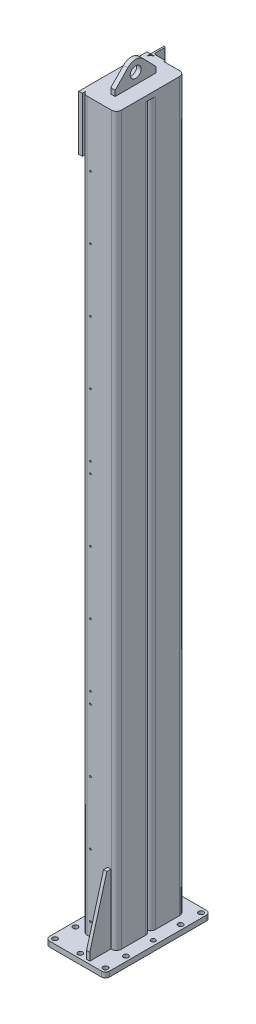
from build123d import *

# Parameters (mm, degrees)
EXTRUDE_1_DEPTH           = 2643
EXTRUDE_2_DEPTH           = 2643
CUT_EXTRUDE_1_DEPTH       = 2648.712267222
CUT_EXTRUDE_1_DEPTH_BACK  = 2648.712267222
EXTRUDE_3_DEPTH           = 19
EXTRUDE_4_DEPTH           = 12
EXTRUDE_5_DEPTH           = 2662
EXTRUDE_6_DEPTH           = 2190
EXTRUDE_7_DEPTH           = 19
SKETCH_14_W               = 249.98
SKETCH_14_H               = 200
EXTRUDE_8_DEPTH           = 13
EXTRUDE_9_DEPTH           = 8
EXTRUDE_9_DEPTH_BACK      = 8
SKETCH_17_R               = 9
CUT_EXTRUDE_3_DEPTH       = 19
SKETCH_19_R               = 8
CUT_EXTRUDE_5_DEPTH       = 19
SKETCH_20_R               = 8
CUT_EXTRUDE_6_DEPTH       = 75.5
SKETCH_21_R               = 8
CUT_EXTRUDE_7_DEPTH       = 75.5
SKETCH_22_R               = 6
CUT_EXTRUDE_8_DEPTH       = 70.5
SKETCH_24_R               = 3
CUT_EXTRUDE_10_DEPTH      = 105
SKETCH_25_R               = 3
CUT_EXTRUDE_11_DEPTH      = 62.5
CUT_EXTRUDE_12_DEPTH      = 2771.06245417
CUT_EXTRUDE_12_DEPTH_BACK = 2771.06245417
SKETCH_26_R               = 20


with BuildPart() as part:
    # ｽｹｯﾁ2 → ﾎﾞｽ - 押し出し1 (new body)
    with BuildSketch(Plane(origin=(0, 19, 0), x_dir=(1, 0, 0), z_dir=(0, 1, 0))):
        with BuildLine():
            Line((44.5, -105), (-44.5, -105))
            ThreePointArc((-44.5, -105), (-57.227922061, -99.727922061), (-62.5, -87))
            Line((-62.5, -87), (-62.5, 2))
            ThreePointArc((-62.5, 2), (-57.227922061, 14.727922061), (-44.5, 20))
            Line((-44.5, 20), (44.5, 20))
            ThreePointArc((44.5, 20), (57.227922061, 14.727922061), (62.5, 2))
            Line((62.5, 2), (62.5, -87))
            ThreePointArc((62.5, -87), (57.227922061, -99.727922061), (44.5, -105))
        make_face()
    extrude(amount=EXTRUDE_1_DEPTH)

    # ｽｹｯﾁ3 → ﾎﾞｽ - 押し出し2 (add)
    with BuildSketch(Plane(origin=(0, 19, 0), x_dir=(1, 0, 0), z_dir=(0, 1, 0))):
        with BuildLine():
            Line((44.5, 20), (-44.5, 20))
            ThreePointArc((-44.5, 20), (-57.227922061, 25.272077939), (-62.5, 38))
            Line((-62.5, 38), (-62.5, 127))
            ThreePointArc((-62.5, 127), (-57.227922061, 139.727922061), (-44.5, 145))
            Line((-44.5, 145), (44.5, 145))
            ThreePointArc((44.5, 145), (57.227922061, 139.727922061), (62.5, 127))
            Line((62.5, 127), (62.5, 38))
            ThreePointArc((62.5, 38), (57.227922061, 25.272077939), (44.5, 20))
        make_face()
    extrude(amount=EXTRUDE_2_DEPTH)

    # ｽｹｯﾁ4 → ｶｯﾄ - 押し出し1 (cut, two sides: drawn at the far end of the back side and taken through both)
    with BuildSketch(Plane(origin=(0, 19, 0), x_dir=(1, 0, 0), z_dir=(0, 1, 0)).offset(-CUT_EXTRUDE_1_DEPTH_BACK)):
        with BuildLine():
            Line((44.5, -96), (-44.5, -96))
            ThreePointArc((-44.5, -96), (-50.863961031, -93.363961031), (-53.5, -87))
            Line((-53.5, -87), (-53.5, 2))
            ThreePointArc((-53.5, 2), (-50.863961031, 8.363961031), (-44.5, 11))
            Line((-44.5, 11), (44.5, 11))
            ThreePointArc((44.5, 11), (50.863961031, 8.363961031), (53.5, 2))
            Line((53.5, 2), (53.5, -87))
            ThreePointArc((53.5, -87), (50.863961031, -93.363961031), (44.5, -96))
        make_face()
        with BuildLine():
            Line((44.5, 29), (-44.5, 29))
            ThreePointArc((-44.5, 29), (-50.863961031, 31.636038969), (-53.5, 38))
            Line((-53.5, 38), (-53.5, 127))
            ThreePointArc((-53.5, 127), (-50.863961031, 133.363961031), (-44.5, 136))
            Line((-44.5, 136), (44.5, 136))
            ThreePointArc((44.5, 136), (50.863961031, 133.363961031), (53.5, 127))
            Line((53.5, 127), (53.5, 38))
            ThreePointArc((53.5, 38), (50.863961031, 31.636038969), (44.5, 29))
        make_face()
    extrude(amount=CUT_EXTRUDE_1_DEPTH + CUT_EXTRUDE_1_DEPTH_BACK, mode=Mode.SUBTRACT)

    # ｽｹｯﾁ5 → ﾎﾞｽ - 押し出し3 (add)
    with BuildSketch(Plane(origin=(0, 0, 0), x_dir=(1, 0, 0), z_dir=(0, 1, 0))):
        with BuildLine():
            Line((95, -192.5), (-95, -192.5))
            ThreePointArc((-95, -192.5), (-105.606601718, -188.106601718), (-110, -177.5))
            Line((-110, -177.5), (-110, 177.5))
            ThreePointArc((-110, 177.5), (-105.606601718, 188.106601718), (-95, 192.5))
            Line((-95, 192.5), (95, 192.5))
            ThreePointArc((95, 192.5), (105.606601718, 188.106601718), (110, 177.5))
            Line((110, 177.5), (110, -177.5))
            ThreePointArc((110, -177.5), (105.606601718, -188.106601718), (95, -192.5))
        make_face()
    extrude(amount=EXTRUDE_3_DEPTH)

    # ｽｹｯﾁ7 → ﾎﾞｽ - 押し出し4 (add)
    with BuildSketch(Plane(origin=(42.5, 0, 0), x_dir=(0, 0, -1), z_dir=(1, 0, 0))):
        Polygon((-105, 19), (-105, 272), (-120, 272), (-182.5, 47), (-182.5, 19), align=None)
    extrude(amount=-EXTRUDE_4_DEPTH)

    # ｽｹｯﾁ8 → ﾎﾞｽ - 押し出し5 (add)
    with BuildSketch(Plane(origin=(0, 19, 0), x_dir=(1, 0, 0), z_dir=(0, 1, 0))):
        with BuildLine():
            Line((-62.5, 145), (-12.5, 145))
            Line((-12.5, 145), (-12.5, 147))
            ThreePointArc((-12.5, 147), (-13.671572875, 149.828427125), (-16.5, 151))
            Line((-16.5, 151), (-50.5, 151))
            ThreePointArc((-50.5, 151), (-54.742640687, 152.757359313), (-56.5, 157))
            Line((-56.5, 157), (-56.5, 191))
            ThreePointArc((-56.5, 191), (-57.671572875, 193.828427125), (-60.5, 195))
            Line((-60.5, 195), (-62.5, 195))
            Line((-62.5, 195), (-62.5, 145))
        make_face()
    extrude(amount=EXTRUDE_5_DEPTH)

    # ｽｹｯﾁ10 → ﾎﾞｽ - 押し出し6 (add)
    with BuildSketch(Plane(origin=(0, 169, 0), x_dir=(1, 0, 0), z_dir=(0, 1, 0))):
        Polygon((-62.5, -40), (-74.5, -40), (-74.5, -27.5), (-70.5, -27.5), (-70.5, 35), (-62.5, 35), align=None)
    extrude(amount=EXTRUDE_6_DEPTH)

    # ｽｹｯﾁ12 → ﾎﾞｽ - 押し出し7 (add)
    with BuildSketch(Plane(origin=(0, 2662, 0), x_dir=(1, 0, 0), z_dir=(0, 1, 0))):
        with BuildLine():
            Line((44.5, -105), (-44.5, -105))
            ThreePointArc((-44.5, -105), (-57.227922061, -99.727922061), (-62.5, -87))
            Line((-62.5, -87), (-62.5, 127))
            ThreePointArc((-62.5, 127), (-57.227922061, 139.727922061), (-44.5, 145))
            Line((-44.5, 145), (44.5, 145))
            ThreePointArc((44.5, 145), (57.227922061, 139.727922061), (62.5, 127))
            Line((62.5, 127), (62.5, -87))
            ThreePointArc((62.5, -87), (57.227922061, -99.727922061), (44.5, -105))
        make_face()
    extrude(amount=EXTRUDE_7_DEPTH)

    # ｽｹｯﾁ14 → ﾎﾞｽ - 押し出し8 (add)
    with BuildSketch(Plane(origin=(-62.5, 0, 0), x_dir=(0, 0, -1), z_dir=(1, 0, 0))):
        with Locations((19.99, 2581)):
            Rectangle(SKETCH_14_W, SKETCH_14_H)
    extrude(amount=-EXTRUDE_8_DEPTH)

    # ｽｹｯﾁ15 → ﾎﾞｽ - 押し出し9 (add, two sides: drawn at the far end of the back side and taken through both)
    with BuildSketch(Plane(origin=(0, 0, 0), x_dir=(0, 0, -1), z_dir=(1, 0, 0)).offset(-EXTRUDE_9_DEPTH_BACK)):
        with BuildLine():
            Line((-55, 2681), (95, 2681))
            Line((95, 2681), (95, 2701))
            Line((95, 2701), (48.749632993, 2748.811123724))
            ThreePointArc((48.749632993, 2748.811123724), (20, 2761), (-8.749632993, 2748.811123724))
            Line((-8.749632993, 2748.811123724), (-55, 2701))
            Line((-55, 2701), (-55, 2681))
        make_face()
    extrude(amount=EXTRUDE_9_DEPTH + EXTRUDE_9_DEPTH_BACK)

    # ｽｹｯﾁ17 → ｶｯﾄ - 押し出し3 (cut)
    with BuildSketch(Plane(origin=(0, 0, 0), x_dir=(1, 0, 0), z_dir=(0, 1, 0))):
        with Locations(Location((92.5, -175, 0), (0, 0, 270))):
            Circle(SKETCH_17_R)
        with Locations(Location((0, -175, 0), (0, 0, 270))):
            Circle(SKETCH_17_R)
        with Locations(Location((-92.5, -175, 0), (0, 0, 270))):
            Circle(SKETCH_17_R)
        with Locations(Location((92.5, -100, 0), (0, 0, 270))):
            Circle(SKETCH_17_R)
        with Locations(Location((-92.5, -100, 0), (0, 0, 270))):
            Circle(SKETCH_17_R)
        with Locations(Location((92.5, 100, 0), (0, 0, 270))):
            Circle(SKETCH_17_R)
        with Locations(Location((-92.5, 100, 0), (0, 0, 270))):
            Circle(SKETCH_17_R)
        with Locations(Location((92.5, 175, 0), (0, 0, 270))):
            Circle(SKETCH_17_R)
        with Locations(Location((0, 175, 0), (0, 0, 270))):
            Circle(SKETCH_17_R)
        with Locations(Location((-92.5, 175, 0), (0, 0, 270))):
            Circle(SKETCH_17_R)
    extrude(amount=CUT_EXTRUDE_3_DEPTH, mode=Mode.SUBTRACT)

    # ｽｹｯﾁ19 → ｶｯﾄ - 押し出し5 (cut)
    with BuildSketch(Plane(origin=(0, 0, 0), x_dir=(1, 0, 0), z_dir=(0, 1, 0))):
        with Locations(Location((92.5, 0, 0), (0, 0, 270))):
            Circle(SKETCH_19_R)
        with Locations(Location((-92.5, 0, 0), (0, 0, 270))):
            Circle(SKETCH_19_R)
    extrude(amount=CUT_EXTRUDE_5_DEPTH, mode=Mode.SUBTRACT)

    # ｽｹｯﾁ20 → ｶｯﾄ - 押し出し6 (cut)
    with BuildSketch(Plane(origin=(0, 0, 0), x_dir=(0, 0, -1), z_dir=(1, 0, 0))):
        with Locations((-85, 2531)):
            Circle(SKETCH_20_R)
        with Locations((125, 2531)):
            Circle(SKETCH_20_R)
        with Locations((-85, 2631)):
            Circle(SKETCH_20_R)
        with Locations((125, 2631)):
            Circle(SKETCH_20_R)
    extrude(amount=-CUT_EXTRUDE_6_DEPTH, mode=Mode.SUBTRACT)

    # ｽｹｯﾁ21 → ｶｯﾄ - 押し出し7 (cut)
    with BuildSketch(Plane(origin=(0, 0, 0), x_dir=(0, 0, -1), z_dir=(1, 0, 0))):
        with Locations((-85, 2581)):
            Circle(SKETCH_21_R)
        with Locations((125, 2581)):
            Circle(SKETCH_21_R)
    extrude(amount=-CUT_EXTRUDE_7_DEPTH, mode=Mode.SUBTRACT)

    # ｽｹｯﾁ22 → ｶｯﾄ - 押し出し8 (cut)
    with BuildSketch(Plane(origin=(0, 0, 0), x_dir=(0, 0, -1), z_dir=(1, 0, 0))):
        with Locations((-5, 214.5)):
            Circle(SKETCH_22_R)
        with Locations((-5, 319.5)):
            Circle(SKETCH_22_R)
        with Locations((-5, 424.5)):
            Circle(SKETCH_22_R)
        with Locations((-5, 529.5)):
            Circle(SKETCH_22_R)
        with Locations((-5, 634.5)):
            Circle(SKETCH_22_R)
        with Locations((-5, 739.5)):
            Circle(SKETCH_22_R)
        with Locations((-5, 844.5)):
            Circle(SKETCH_22_R)
        with Locations((-5, 949.5)):
            Circle(SKETCH_22_R)
        with Locations((-5, 1054.5)):
            Circle(SKETCH_22_R)
        with Locations((-5, 1159.5)):
            Circle(SKETCH_22_R)
        with Locations((-5, 1264.5)):
            Circle(SKETCH_22_R)
        with Locations((-5, 1369.5)):
            Circle(SKETCH_22_R)
        with Locations((-5, 1474.5)):
            Circle(SKETCH_22_R)
        with Locations((-5, 1579.5)):
            Circle(SKETCH_22_R)
        with Locations((-5, 1684.5)):
            Circle(SKETCH_22_R)
        with Locations((-5, 1789.5)):
            Circle(SKETCH_22_R)
        with Locations((-5, 1894.5)):
            Circle(SKETCH_22_R)
        with Locations((-5, 1999.5)):
            Circle(SKETCH_22_R)
        with Locations((-5, 2104.5)):
            Circle(SKETCH_22_R)
        with Locations((-5, 2209.5)):
            Circle(SKETCH_22_R)
        with Locations((-5, 2314.5)):
            Circle(SKETCH_22_R)
    extrude(amount=-CUT_EXTRUDE_8_DEPTH, mode=Mode.SUBTRACT)

    # ｽｹｯﾁ24 → ｶｯﾄ - 押し出し10 (cut)
    with BuildSketch(Plane.XY):
        with Locations(Location((-32.5, 2448.5, 0), (0, 0, 180))):
            Circle(SKETCH_24_R)
        with Locations(Location((-32.5, 2218.5, 0), (0, 0, 180))):
            Circle(SKETCH_24_R)
        with Locations(Location((-32.5, 1988.5, 0), (0, 0, 180))):
            Circle(SKETCH_24_R)
        with Locations(Location((-32.5, 1758.5, 0), (0, 0, 180))):
            Circle(SKETCH_24_R)
        with Locations(Location((-32.5, 1528.5, 0), (0, 0, 180))):
            Circle(SKETCH_24_R)
        with Locations(Location((-32.5, 1488.5, 0), (0, 0, 180))):
            Circle(SKETCH_24_R)
        with Locations(Location((-32.5, 1258.5, 0), (0, 0, 180))):
            Circle(SKETCH_24_R)
        with Locations(Location((-32.5, 1028.5, 0), (0, 0, 180))):
            Circle(SKETCH_24_R)
        with Locations(Location((-32.5, 798.5, 0), (0, 0, 180))):
            Circle(SKETCH_24_R)
        with Locations(Location((-32.5, 758.5, 0), (0, 0, 180))):
            Circle(SKETCH_24_R)
        with Locations(Location((-32.5, 528.5, 0), (0, 0, 180))):
            Circle(SKETCH_24_R)
        with Locations(Location((-32.5, 298.5, 0), (0, 0, 180))):
            Circle(SKETCH_24_R)
        with Locations(Location((-32.5, 68.5, 0), (0, 0, 180))):
            Circle(SKETCH_24_R)
    extrude(amount=CUT_EXTRUDE_10_DEPTH, mode=Mode.SUBTRACT)

    # ｽｹｯﾁ25 → ｶｯﾄ - 押し出し11 (cut)
    with BuildSketch(Plane(origin=(0, 0, 0), x_dir=(0, 0, -1), z_dir=(1, 0, 0))):
        with Locations((180, 60)):
            Circle(SKETCH_25_R)
        with Locations((180, 480)):
            Circle(SKETCH_25_R)
        with Locations((180, 900)):
            Circle(SKETCH_25_R)
        with Locations((180, 1320)):
            Circle(SKETCH_25_R)
        with Locations((180, 1740)):
            Circle(SKETCH_25_R)
        with Locations((180, 2160)):
            Circle(SKETCH_25_R)
        with Locations((180, 2580)):
            Circle(SKETCH_25_R)
    extrude(amount=-CUT_EXTRUDE_11_DEPTH, mode=Mode.SUBTRACT)

    # ｽｹｯﾁ26 → ｶｯﾄ - 押し出し12 (cut, two sides: drawn at the far end of the back side and taken through both)
    with BuildSketch(Plane(origin=(0, 0, 0), x_dir=(0, 0, -1), z_dir=(1, 0, 0)).offset(-CUT_EXTRUDE_12_DEPTH_BACK)):
        with Locations((20, 2721)):
            Circle(SKETCH_26_R)
    extrude(amount=CUT_EXTRUDE_12_DEPTH + CUT_EXTRUDE_12_DEPTH_BACK, mode=Mode.SUBTRACT)


solid = part.part
